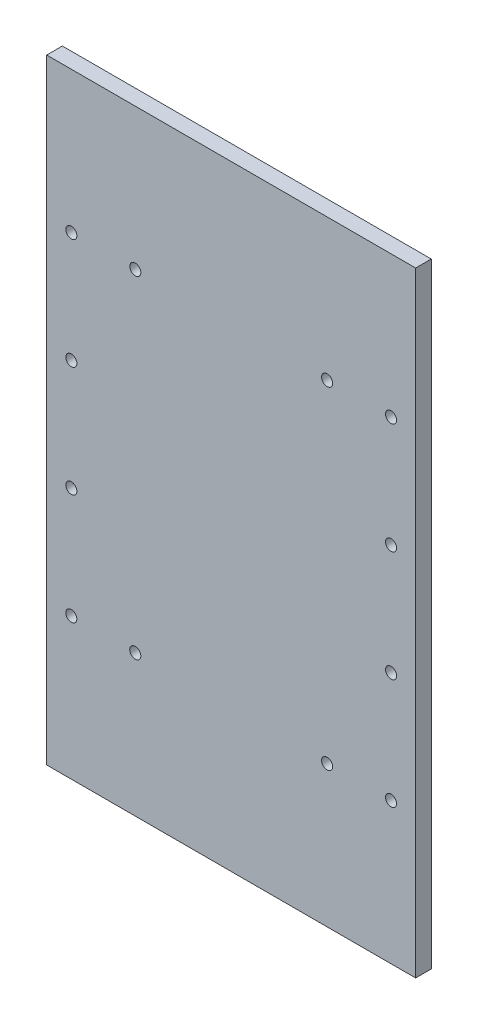
from build123d import *

# Parameters (mm, degrees)
SKETCH1_W            = 150
SKETCH1_H            = 250
BOSS_EXTRUDE1_DEPTH  = 6.35
M4_CLEARANCE_HOLE1_D = 4.5
M4_CLEARANCE_HOLE2_D = 4.5


with BuildPart() as part:
    # Sketch1 → Boss-Extrude1 (new body)
    with BuildSketch(Plane.XY):
        with Locations((75, 125)):
            Rectangle(SKETCH1_W, SKETCH1_H)
    extrude(amount=BOSS_EXTRUDE1_DEPTH)

    # M4 Clearance Hole1 (through all)
    with Locations(Plane.XY.offset(6.35)):
        with Locations((10, 192.5), (10, 147.5), (10, 102.5), (140, 192.5), (140, 147.5), (140, 102.5), (10, 57.5), (140, 57.5)):
            Hole(M4_CLEARANCE_HOLE1_D / 2)

    # M4 Clearance Hole2 (through all)
    with Locations(Plane.XY.offset(6.35)):
        with Locations((36, 57.5), (36, 192.5), (114, 192.5), (114, 57.5)):
            Hole(M4_CLEARANCE_HOLE2_D / 2)


solid = part.part
